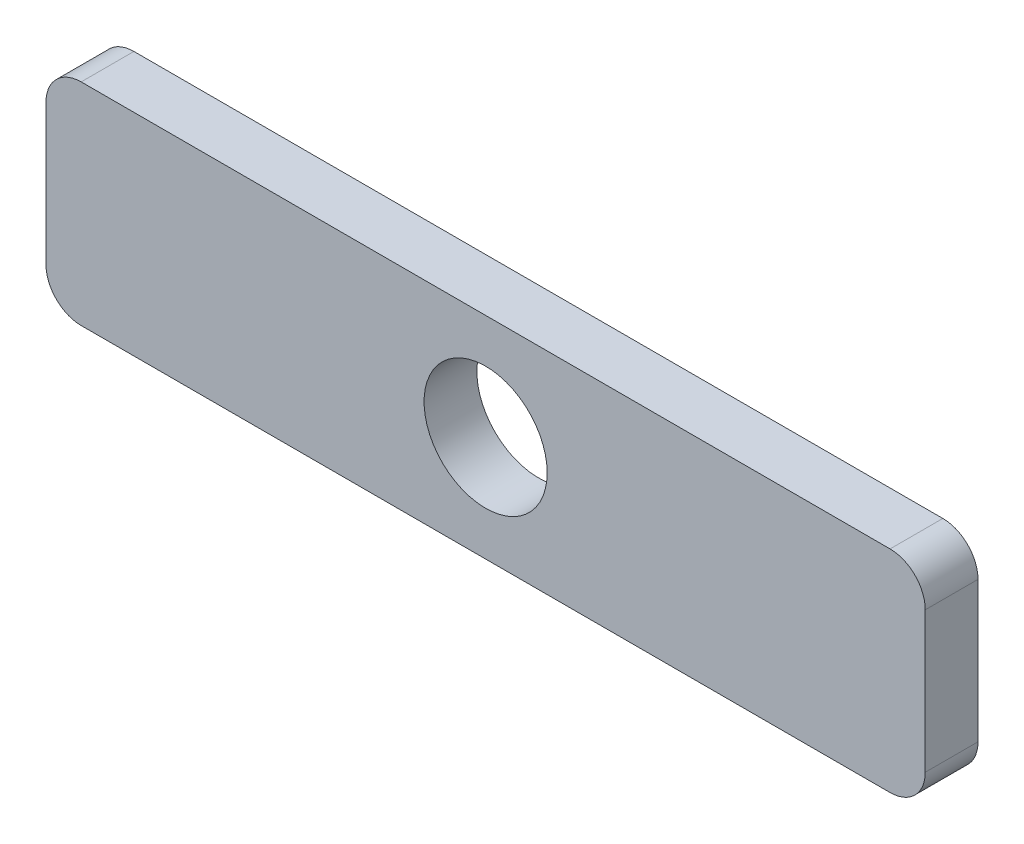
from build123d import *

# Parameters (mm, degrees)
SKETCH1_W           = 50
SKETCH1_H           = 12
SKETCH1_R           = 3.5
BOSS_EXTRUDE1_DEPTH = 3
FILLET1_R           = 2


with BuildPart() as part:
    # Sketch1 → Boss-Extrude1 (new body)
    with BuildSketch(Plane.XY):
        Rectangle(SKETCH1_W, SKETCH1_H)
        Circle(SKETCH1_R, mode=Mode.SUBTRACT)
    extrude(amount=BOSS_EXTRUDE1_DEPTH)

    # Fillet1
    fillet1_edges = [part.edges().sort_by_distance(p)[0] for p in [
        (25, -6, 1.5),
        (-25, -6, 1.5),
        (-25, 6, 1.5),
        (25, 6, 1.5),
    ]]
    fillet(fillet1_edges, radius=FILLET1_R)


solid = part.part
